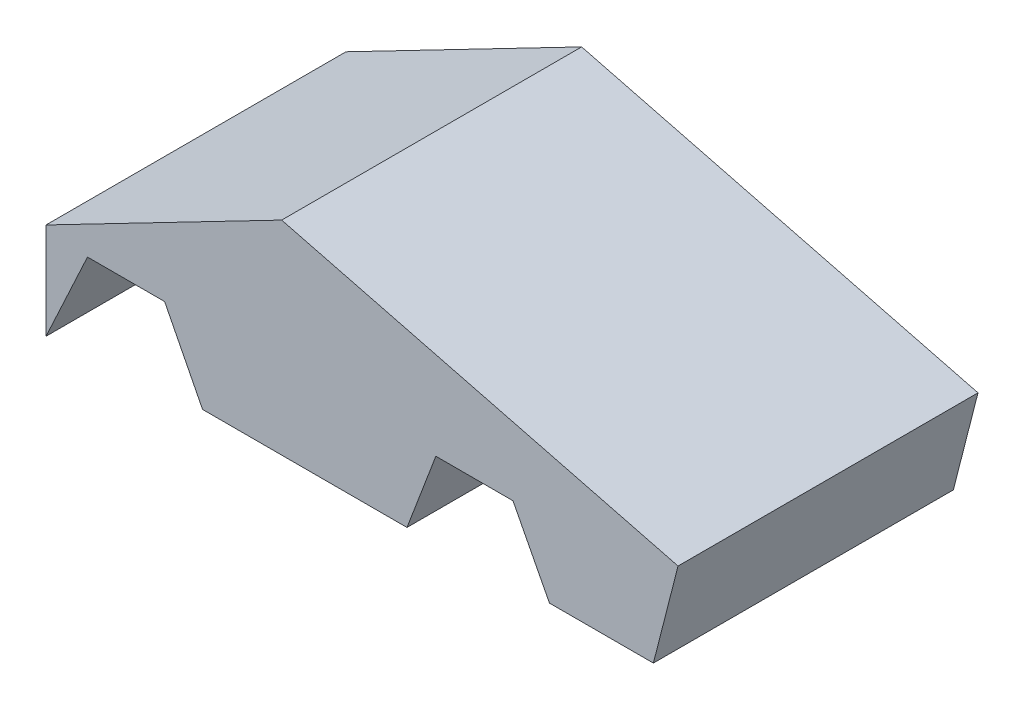
from build123d import *

# Parameters (mm, degrees)
BOSS_EXTRUDE1_DEPTH = 140


with BuildPart() as part:
    # Sketch1 → Boss-Extrude1 (new body)
    with BuildSketch(Plane.XY):
        Polygon((104.431663255, 46.182397048), (-5.568336745, -10.791132755), (-5.568336745, -55.791132755), (13.801565383, -14.068154775), (49.801565383, -14.068154775), (67.501592841, -48.820263028), (162.916386918, -48.820263028), (176.391501363, -13.289694629), (212.391501363, -13.289694629), (229.408285642, -46.144360246), (277.919749319, -46.144360246), (289.431663255, -1.144360246), align=None)
    extrude(amount=BOSS_EXTRUDE1_DEPTH)


solid = part.part
